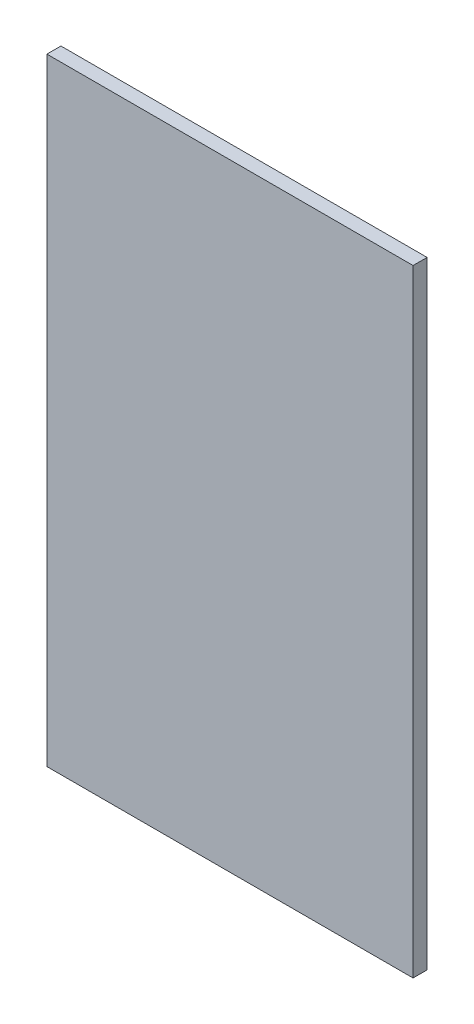
from build123d import *

# Parameters (mm, degrees)
SKETCH1_W           = 470
SKETCH1_H           = 792
BOSS_EXTRUDE1_DEPTH = 18


with BuildPart() as part:
    # Sketch1 → Boss-Extrude1 (new body)
    with BuildSketch(Plane.XY):
        with Locations((235, 396)):
            Rectangle(SKETCH1_W, SKETCH1_H)
    extrude(amount=BOSS_EXTRUDE1_DEPTH)


solid = part.part
